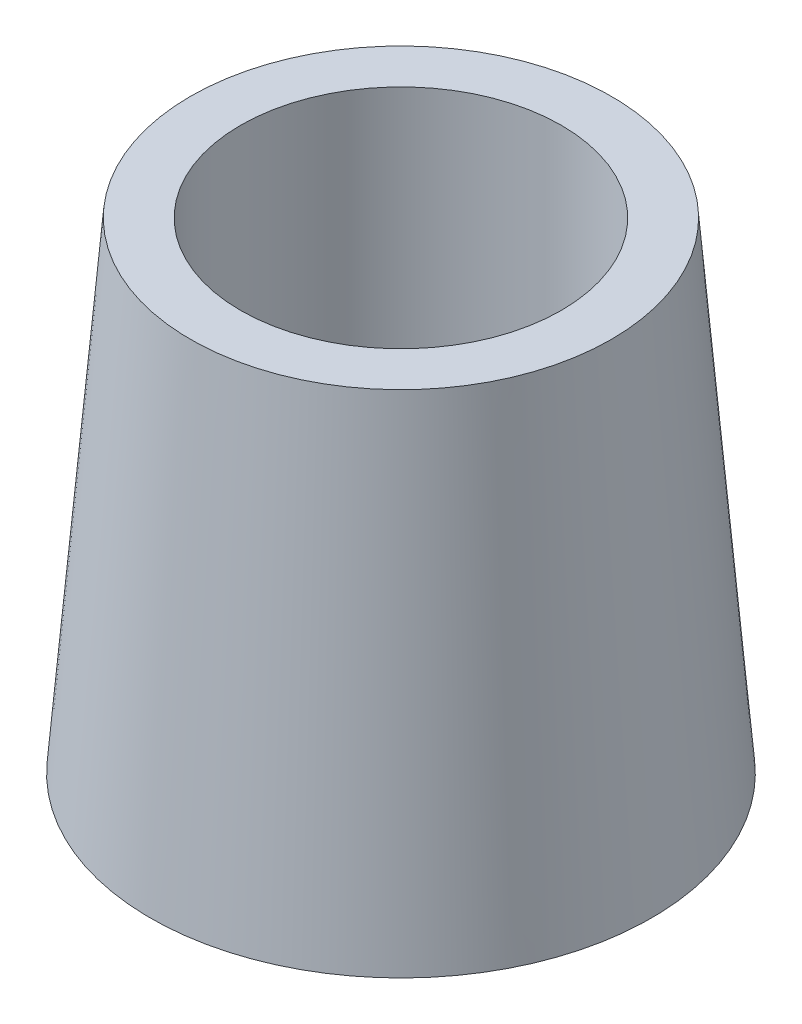
from build123d import *

# Parameters (mm, degrees)
CUT_EXTRUDE1_DEPTH      = 30.807717122
CUT_EXTRUDE1_DEPTH_BACK = 30.807717122
SKETCH2_R               = 8


with BuildPart() as part:
    # Sketch1 → Revolve1 (revolve)
    with BuildSketch(Plane.XY):
        Polygon((0, 0), (-12.5, 0), (-10.5, 24), (0, 24), align=None)
    revolve(axis=Axis((0, 24, 0), (0, -1, 0)))

    # Sketch2 → Cut-Extrude1 (cut, two sides: drawn at the far end of the back side and taken through both)
    with BuildSketch(Plane(origin=(0, 24, 0), x_dir=(1, 0, 0), z_dir=(0, 1, 0)).offset(-CUT_EXTRUDE1_DEPTH_BACK)):
        with Locations(Location((0, 0, 0), (0, 0, 180))):
            Circle(SKETCH2_R)
    extrude(amount=CUT_EXTRUDE1_DEPTH + CUT_EXTRUDE1_DEPTH_BACK, mode=Mode.SUBTRACT)


solid = part.part
